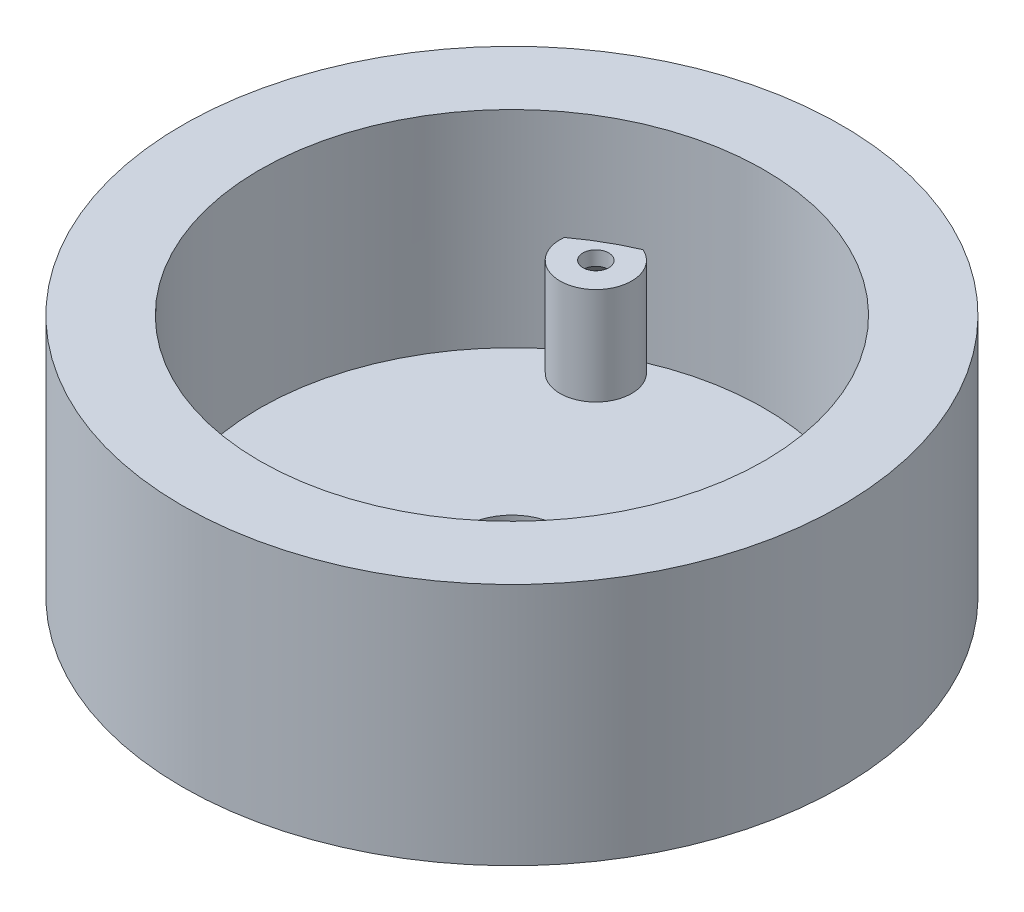
from build123d import *

# Parameters (mm, degrees)
SKETCH1_R                                    = 23
BOSS_EXTRUDE1_DEPTH                          = 17
SHELL1_T                                     = -2.6
SKETCH22_R                                   = 20.400000000000006
SKETCH22_R_2                                 = 17.6
BOSS_EXTRUDE10_DEPTH                         = 14.4
SKETCH24_R                                   = 2.5000000000000004
SKETCH24_R_2                                 = 2.4999999999999982
BOSS_EXTRUDE11_DEPTH                         = 6.8
CSK_SLOT_FOR_M1_6_COUNTERSUNK_FLAT_H_2_COUNT = 2
CSK_SLOT_FOR_M1_6_COUNTERSUNK_FLAT_H_2_PITCH = 27.712812921102078
CSK_SLOT_FOR_M1_6_COUNTERSUNK_FLAT_H_3_COUNT = 2
CSK_SLOT_FOR_M1_6_COUNTERSUNK_FLAT_H_3_PITCH = 27.712812921101964
BOSS_EXTRUDE12_DEPTH                         = 6
SKETCH29_W                                   = 1.9999999999999991
SKETCH29_H                                   = 3
CUT_EXTRUDE5_DEPTH                           = 47.00572879607992
FILLET2_R                                    = 2
CUT_EXTRUDE6_DEPTH                           = 4.5
BOSS_EXTRUDE13_DEPTH                         = 0.6
BOSS_EXTRUDE14_DEPTH                         = 0.6
CUT_EXTRUDE7_DEPTH                           = 40.83716857408418
SKETCH35_R                                   = 3.3000000000000003
CUT_EXTRUDE8_DEPTH                           = 36.57189902155914


with BuildPart() as part:
    # Sketch1 → Boss-Extrude1 (new body)
    with BuildSketch(Plane(origin=(0, 0, 0), x_dir=(1, 0, 0), z_dir=(0, 1, 0))):
        with Locations(Location((0, 0, 0), (0, 0, 270))):
            Circle(SKETCH1_R)
    extrude(amount=BOSS_EXTRUDE1_DEPTH)

    # Shell1
    shell1_openings = [part.faces().sort_by_distance(p)[0] for p in [
        (0, 17, 0),
    ]]
    offset(amount=SHELL1_T, openings=shell1_openings, kind=Kind.INTERSECTION)

    # Sketch22 → Boss-Extrude10 (add)
    with BuildSketch(Plane(origin=(0, 2.6, 0), x_dir=(1, 0, 0), z_dir=(0, 1, 0))):
        Circle(SKETCH22_R)
        with Locations(Location((0, 0, 0), (0, 0, 270))):
            Circle(SKETCH22_R_2, mode=Mode.SUBTRACT)
    extrude(amount=BOSS_EXTRUDE10_DEPTH)

    # Sketch24 → Boss-Extrude11 (add)
    with BuildSketch(Plane(origin=(0, 2.6, 0), x_dir=(1, 0, 0), z_dir=(0, 1, 0))):
        with Locations((-8.000000000000066, 13.856406460550984)):
            Circle(SKETCH24_R)
        with Locations((16.00000000000061, 1.09033e-12)):
            Circle(SKETCH24_R_2)
        with Locations((-7.999999999998755, -13.856406460551078)):
            Circle(SKETCH24_R)
    extrude(amount=BOSS_EXTRUDE11_DEPTH)

    # Sketch26 → CSK SLOT for M1.6 Countersunk Flat Head (revolve, cut)
    with BuildSketch(Plane(origin=(-7.999999999999872, 0, 13.856406460551092), x_dir=(0, 0, -1), z_dir=(1, 0, 0))):
        Polygon((0, 0), (-4.16e-15, 17), (0.899999999999995, 17), (0.899999999999999, 8.4), (1.799999999999998, 7.5), (1.7999999999999996, -3.47e-15), align=None)
    csk_slot_for_m1_6_countersunk_flat_head = revolve(axis=Axis((-7.999999999999872, -6.349999999999991, 13.856406460551092), (0, 1, 0)), mode=Mode.SUBTRACT)

    # CSK SLOT for M1.6 Countersunk Flat H 2: CSK SLOT for M1.6 Countersunk Flat Head ×2
    with Locations(*[(0, 0, -i * CSK_SLOT_FOR_M1_6_COUNTERSUNK_FLAT_H_2_PITCH) for i in range(1, CSK_SLOT_FOR_M1_6_COUNTERSUNK_FLAT_H_2_COUNT)]):
        add(csk_slot_for_m1_6_countersunk_flat_head, mode=Mode.SUBTRACT)

    # CSK SLOT for M1.6 Countersunk Flat H 3: CSK SLOT for M1.6 Countersunk Flat Head ×2
    with Locations(*[Vector(0.8660254037844364, 0, -0.5000000000000041) * (i * CSK_SLOT_FOR_M1_6_COUNTERSUNK_FLAT_H_3_PITCH) for i in range(1, CSK_SLOT_FOR_M1_6_COUNTERSUNK_FLAT_H_3_COUNT)]):
        add(csk_slot_for_m1_6_countersunk_flat_head, mode=Mode.SUBTRACT)

    # Sketch28 → Boss-Extrude12 (add)
    with BuildSketch(Plane.XZ):
        Polygon((2.0319134377332504, -16.7026098711818), (13.309106732280016, -10.235391659506115), (0.3746703089286471, 12.318994929587399), (-10.90252298561811, 5.8517767179117195), align=None)
    extrude(amount=BOSS_EXTRUDE12_DEPTH)

    # Sketch29 → Cut-Extrude5 (cut, through all)
    with BuildSketch(Plane(origin=(-5.223545835654305, 0, 9.108543139189257), x_dir=(0.8674764072728275, 0, 0.4974783239750529), z_dir=(-0.4974783239750529, 0, 0.8674764072728275))):
        with Locations((-5.5465493958704535, -1.5)):
            Rectangle(SKETCH29_W, SKETCH29_H)
        Polygon((6.453450604129538, 1.59e-15), (6.453450604129538, -2.9999999999999982), (4.453450604129538, -2.9999999999999987), (4.453450604129538, 1.1e-15), align=None)
    extrude(amount=-CUT_EXTRUDE5_DEPTH, mode=Mode.SUBTRACT)

    # Fillet2
    fillet2_edges = [part.edges().sort_by_distance(p)[0] for p in [
        (-10.90252298561811, -4.5, 5.8517767179117195),
        (0.3746703089286471, -4.499999999999999, 12.318994929587399),
        (-5.263926338344731, -6, 9.08538582374956),
    ]]
    fillet(fillet2_edges, radius=FILLET2_R)

    # Sketch30 → Cut-Extrude6 (cut)
    with BuildSketch(Plane(origin=(-5.223545835654305, 0, 9.108543139189257), x_dir=(0.8674764072728275, 0, 0.4974783239750529), z_dir=(-0.4974783239750529, 0, 0.8674764072728275))):
        Polygon((3.953450604129541, -2.6999999999999975), (-4.046549395870457, -2.7), (-4.046549395870457, -6), (3.953450604129543, -5.999999999999997), align=None)
    extrude(amount=-CUT_EXTRUDE6_DEPTH, mode=Mode.SUBTRACT)

    # Sketch31 → Boss-Extrude13 (add)
    with BuildSketch(Plane.XZ.offset(6)):
        Polygon((-6.495179509548303, 3.1918286951216346), (0.44463174863431776, 7.171655286922058), (-1.1472988880858548, 9.947579790195107), (-8.087110146268472, 5.967753198394682), align=None)
    extrude(amount=-BOSS_EXTRUDE13_DEPTH)

    # Sketch33 → Boss-Extrude14 (add)
    with BuildSketch(Plane(origin=(0, -5.4, 0), x_dir=(1, 0, 0), z_dir=(0, 1, 0))):
        Polygon((-6.4951795095483025, -3.191828695121635), (0.44463174863431776, -7.171655286922058), (-0.5503248993157871, -8.906608101467711), (-7.490136157498408, -4.926781509667289), align=None)
    extrude(amount=BOSS_EXTRUDE14_DEPTH)

    # Sketch34 → Cut-Extrude7 (cut, through all)
    with BuildSketch(Plane.XZ.offset(6)):
        Polygon((-6.352157331722817, 6.962709846344788), (-3.1185482258849735, 1.3241131990714121), (0.35135740320633424, 3.314026494971624), (-2.8822517026315113, 8.952623142245), align=None)
    extrude(amount=-CUT_EXTRUDE7_DEPTH, mode=Mode.SUBTRACT)

    # Sketch35 → Cut-Extrude8 (cut, through all)
    with BuildSketch(Plane(origin=(0, 2.6, 0), x_dir=(1, 0, 0), z_dir=(0, 1, 0))):
        Circle(SKETCH35_R)
    extrude(amount=-CUT_EXTRUDE8_DEPTH, mode=Mode.SUBTRACT)


solid = part.part
